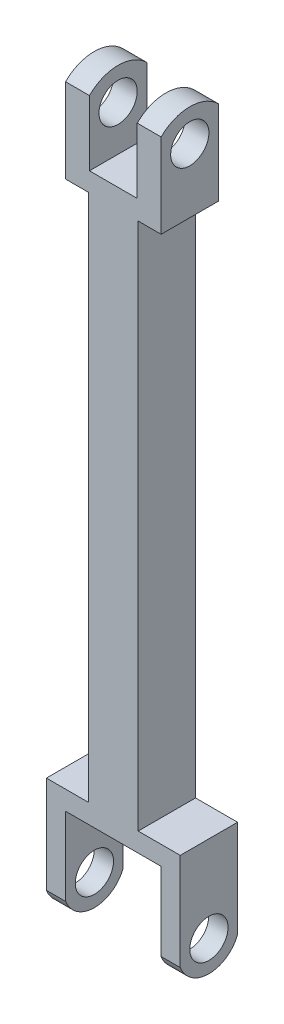
from build123d import *

# Parameters (mm, degrees)
CROQUIS1_W              = 5
CROQUIS1_H              = 33
SALIENTE_EXTRUIR1_DEPTH = 3
CROQUIS3_W              = 7
CROQUIS3_H              = 3
SALIENTE_EXTRUIR2_DEPTH = 7
CORTAR_EXTRUIR1_REACH   = 75.478
CROQUIS4_W              = 4.98
CROQUIS4_H              = 6
CROQUIS5_R              = 1
CORTAR_EXTRUIR4_DEPTH   = 15
CORTAR_EXTRUIR5_DEPTH   = 15
CROQUIS8_W              = 2.5
CROQUIS8_H              = 4.326412588
CORTAR_EXTRUIR6_DEPTH   = 10
CORTAR_EXTRUIR7_REACH   = 75.146
CROQUIS9_W              = 1.2
CROQUIS9_H              = 27.63275501


with BuildPart() as part:
    # Croquis1 → Saliente-Extruir1 (new body)
    with BuildSketch(Plane.XY):
        with Locations((-8.507787801, 55.928529755)):
            Rectangle(CROQUIS1_W, CROQUIS1_H)
    extrude(amount=SALIENTE_EXTRUIR1_DEPTH)

    # Croquis3 → Saliente-Extruir2 (add)
    with BuildSketch(Plane.XZ.offset(-39.428529755)):
        with Locations((-8.507787801, 1.5)):
            Rectangle(CROQUIS3_W, CROQUIS3_H)
    extrude(amount=SALIENTE_EXTRUIR2_DEPTH)

    # Croquis4 → Cortar-Extruir1 (cut, up to next)
    with BuildSketch(Plane.XY.offset(3), mode=Mode.PRIVATE) as cortar_extruir1_sk1:
        with Locations((-8.507787801, 35.428529755)):
            Rectangle(CROQUIS4_W, CROQUIS4_H)
    cortar_extruir1_tool1 = extrude(cortar_extruir1_sk1.sketch, amount=-CORTAR_EXTRUIR1_REACH, mode=Mode.PRIVATE) & part.part
    add(cortar_extruir1_tool1.solids().sort_by_distance((-8.507788, 35.42853, 3))[0], mode=Mode.SUBTRACT)

    # Croquis5 → Cortar-Extruir4 (cut)
    with BuildSketch(Plane.ZY.offset(12.007787801)):
        with Locations(Location((1.5, 70.414414657, 0), (0, 0, 270))):
            Circle(CROQUIS5_R)
        with Locations((1.5, 34.917908979)):
            Circle(CROQUIS5_R)
    extrude(amount=-CORTAR_EXTRUIR4_DEPTH, mode=Mode.SUBTRACT)

    # Croquis7 → Cortar-Extruir5 (cut)
    with BuildSketch(Plane.ZY.offset(12.007787801)):
        with BuildLine():
            Line((3, 71.470870039), (3, 72.821585946))
            Line((3, 72.821585946), (0, 72.821585946))
            Line((0, 72.821585946), (0, 71.470870039))
            ThreePointArc((0, 71.470870039), (1.5, 72.091024013), (3, 71.470870039))
        make_face()
        with BuildLine():
            Line((0, 34.344024201), (0, 31.961571753))
            Line((0, 31.961571753), (3, 31.961571753))
            Line((3, 31.961571753), (3, 34.344024201))
            ThreePointArc((3, 34.344024201), (1.5, 33.311875437), (0, 34.344024201))
        make_face()
    extrude(amount=-CORTAR_EXTRUIR5_DEPTH, mode=Mode.SUBTRACT)

    # Croquis8 → Cortar-Extruir6 (cut)
    with BuildSketch(Plane.XY.offset(3)):
        with Locations((-8.507787801, 70.224491059)):
            Rectangle(CROQUIS8_W, CROQUIS8_H)
    extrude(amount=-CORTAR_EXTRUIR6_DEPTH, mode=Mode.SUBTRACT)

    # Croquis9 → Cortar-Extruir7 (cut, up to next)
    with BuildSketch(Plane.XY.offset(3), mode=Mode.PRIVATE) as cortar_extruir7_sk1:
        with Locations((-10.407787801, 53.24490726)):
            Rectangle(CROQUIS9_W, CROQUIS9_H)
    cortar_extruir7_tool1 = extrude(cortar_extruir7_sk1.sketch, amount=-CORTAR_EXTRUIR7_REACH, mode=Mode.PRIVATE) & part.part
    # Croquis9 → Cortar-Extruir7 (cut, up to next)
    with BuildSketch(Plane.XY.offset(3), mode=Mode.PRIVATE) as cortar_extruir7_sk2:
        with Locations((-6.607787801, 53.24490726)):
            Rectangle(CROQUIS9_W, CROQUIS9_H)
    cortar_extruir7_tool2 = extrude(cortar_extruir7_sk2.sketch, amount=-CORTAR_EXTRUIR7_REACH, mode=Mode.PRIVATE) & part.part
    add(cortar_extruir7_tool1.solids().sort_by_distance((-10.407788, 53.244907, 3))[0], mode=Mode.SUBTRACT)
    add(cortar_extruir7_tool2.solids().sort_by_distance((-6.607788, 53.244907, 3))[0], mode=Mode.SUBTRACT)


solid = part.part
